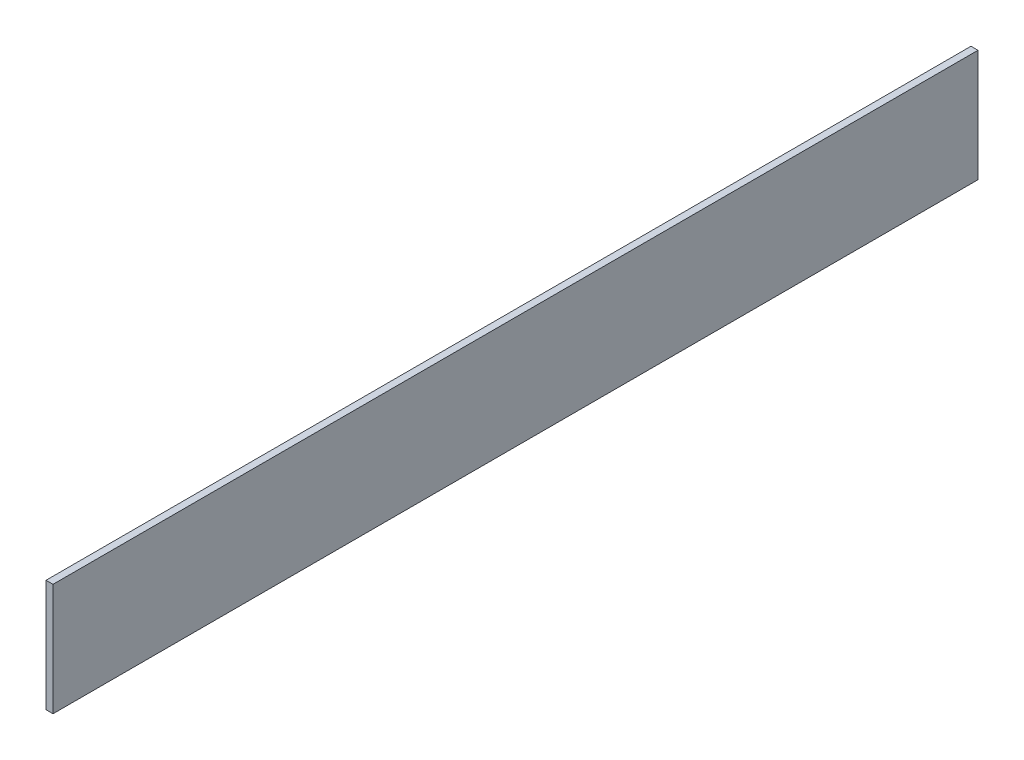
from build123d import *

# Parameters (mm, degrees)
PACK_KALIP_DUVARI_SAG_1_START = -235
SKETCH1_W                     = 2.5
SKETCH1_H                     = 40
PACK_KALIP_DUVARI_SAG_1_DEPTH = 330


with BuildPart() as part:
    # Sketch1 → PACK_kalip_duvari_sag_1 (new body)
    with BuildSketch(Plane.XY.offset(PACK_KALIP_DUVARI_SAG_1_START)):
        with Locations((513.75, 572)):
            Rectangle(SKETCH1_W, SKETCH1_H)
    extrude(amount=-PACK_KALIP_DUVARI_SAG_1_DEPTH)


solid = part.part
